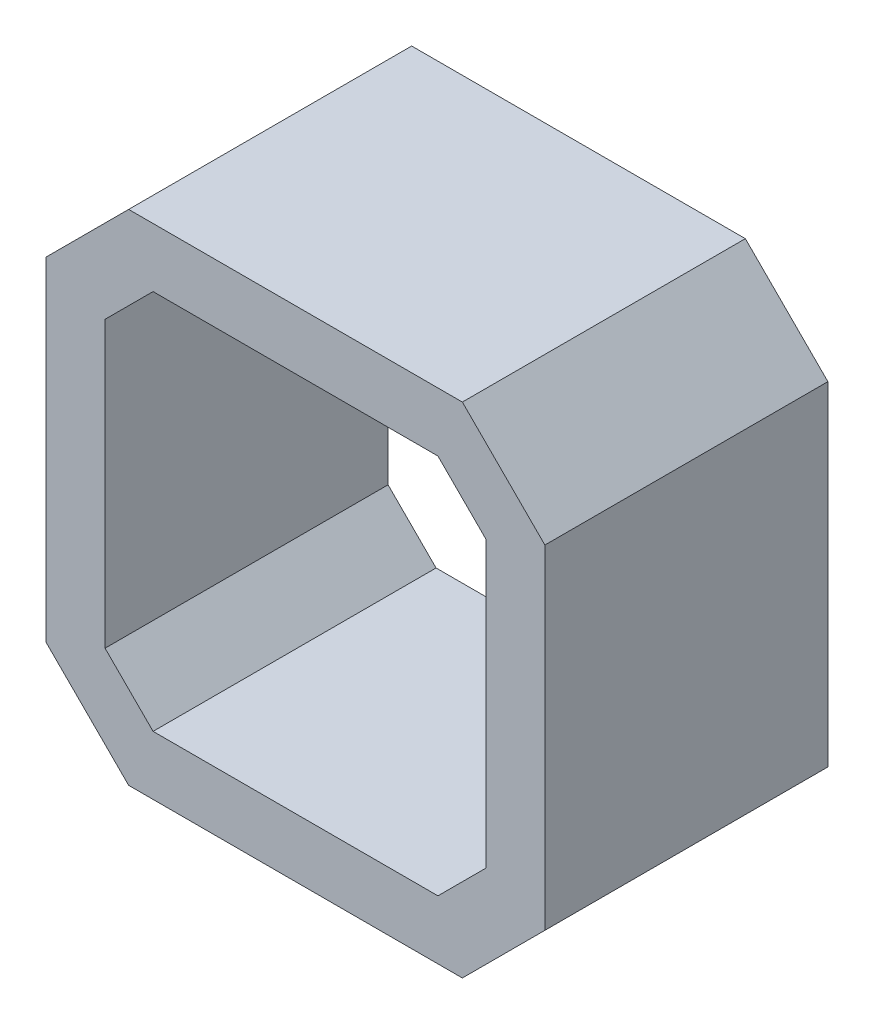
from build123d import *

# Parameters (mm, degrees)
BOSS_EXTRUDE1_DEPTH = 24


with BuildPart() as part:
    # Sketch1 → Boss-Extrude1 (new body)
    with BuildSketch(Plane.XY):
        Polygon((-14.15, 21.15), (-21.15, 14.15), (-21.15, -14.15), (-14.15, -21.15), (14.15, -21.15), (21.15, -14.15), (21.15, 14.15), (14.15, 21.15), align=None)
        Polygon((-12.078932188, 16.15), (-16.15, 12.078932188), (-16.15, -12.078932188), (-12.078932188, -16.15), (12.078932188, -16.15), (16.15, -12.078932188), (16.15, 12.078932188), (12.078932188, 16.15), align=None, mode=Mode.SUBTRACT)
    extrude(amount=BOSS_EXTRUDE1_DEPTH)


solid = part.part
